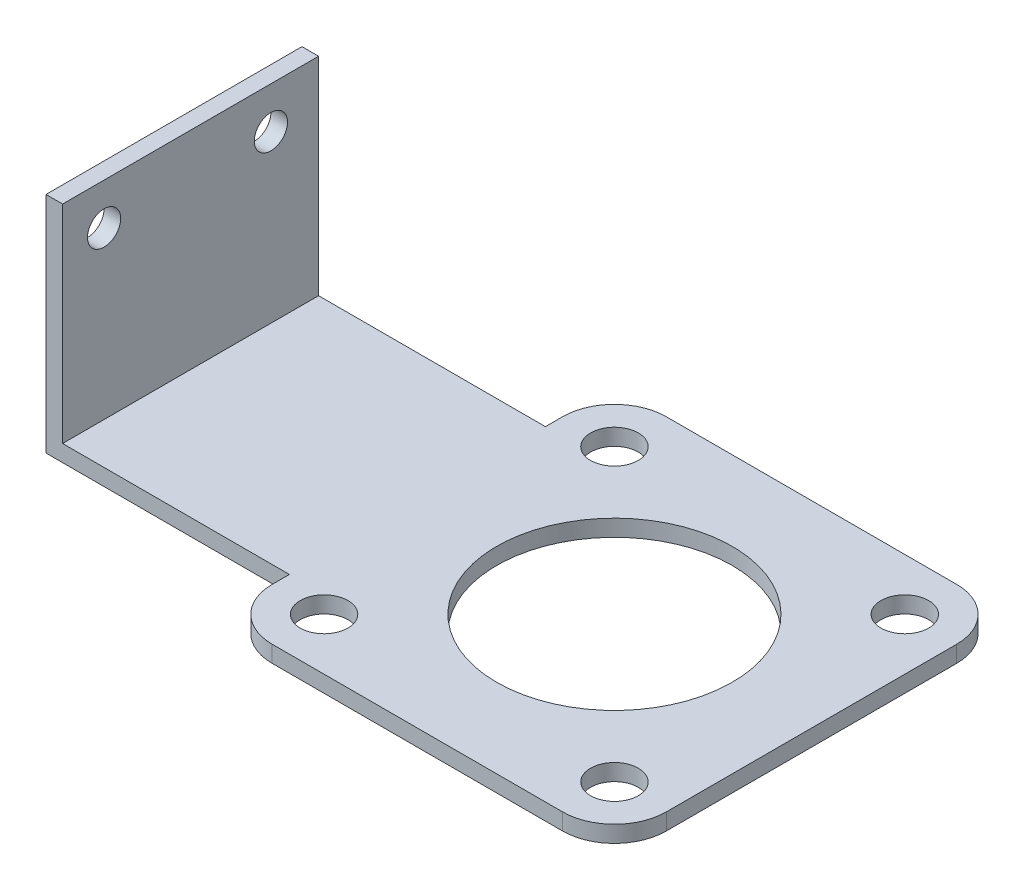
from build123d import *

# Parameters (mm, degrees)
BOSS_EXTRUDE1_DEPTH     = 4
CUT_EXTRUDE1_DEPTH      = 10
CUT_EXTRUDE1_DEPTH_BACK = 10
SKETCH2_R               = 5.75
BOSS_EXTRUDE5_DEPTH     = 58.68
SKETCH12_W              = 4
SKETCH12_H              = 61.717483032
BOSS_EXTRUDE8_DEPTH     = 50
SKETCH13_R              = 4
CUT_EXTRUDE5_DEPTH      = 20
SKETCH14_R              = 28.395
CUT_EXTRUDE6_DEPTH      = 10


with BuildPart() as part:
    # Sketch1 → Boss-Extrude1 (new body)
    with BuildSketch(Plane(origin=(0, 0, 0), x_dir=(1, 0, 0), z_dir=(0, 1, 0))):
        with BuildLine():
            Line((12.5, 0), (82.5, 0))
            ThreePointArc((82.5, 0), (91.338834765, 3.661165235), (95, 12.5))
            Line((95, 12.5), (95, 82.5))
            ThreePointArc((95, 82.5), (91.338834765, 91.338834765), (82.5, 95))
            Line((82.5, 95), (12.5, 95))
            ThreePointArc((12.5, 95), (3.661165235, 91.338834765), (0, 82.5))
            Line((0, 82.5), (0, 12.5))
            ThreePointArc((0, 12.5), (3.661165235, 3.661165235), (12.5, 0))
        make_face()
    extrude(amount=BOSS_EXTRUDE1_DEPTH)

    # Sketch2 → Cut-Extrude1 (cut, two sides: drawn at the far end of the back side and taken through both)
    with BuildSketch(Plane(origin=(0, 4, 0), x_dir=(1, 0, 0), z_dir=(0, 1, 0)).offset(-CUT_EXTRUDE1_DEPTH_BACK)):
        with Locations(Location((12.5, 82.5, 0), (0, 0, 90))):
            Circle(SKETCH2_R)
        with Locations(Location((82.5, 82.5, 0), (0, 0, 90))):
            Circle(SKETCH2_R)
        with Locations(Location((12.5, 12.5, 0), (0, 0, 90))):
            Circle(SKETCH2_R)
        with Locations(Location((82.5, 12.5, 0), (0, 0, 90))):
            Circle(SKETCH2_R)
    extrude(amount=CUT_EXTRUDE1_DEPTH + CUT_EXTRUDE1_DEPTH_BACK, mode=Mode.SUBTRACT)

    # Sketch8 → Boss-Extrude5 (add)
    with BuildSketch(Plane.ZY):
        Polygon((-17.641258484, 4), (-16.641258484, 4), (-16.641258484, 0), (-78.358741516, 0), (-78.358741516, 4), (-77.358741516, 4), align=None)
    extrude(amount=BOSS_EXTRUDE5_DEPTH)

    # Sketch12 → Boss-Extrude8 (add)
    with BuildSketch(Plane(origin=(0, 4, 0), x_dir=(1, 0, 0), z_dir=(0, 1, 0))):
        with Locations((-56.68, 47.5)):
            Rectangle(SKETCH12_W, SKETCH12_H)
    extrude(amount=BOSS_EXTRUDE8_DEPTH)

    # Sketch13 → Cut-Extrude5 (cut)
    with BuildSketch(Plane.ZY.offset(58.68)):
        with Locations((-66.858741516, 44)):
            Circle(SKETCH13_R)
        with Locations((-26.641258484, 44)):
            Circle(SKETCH13_R)
    extrude(amount=-CUT_EXTRUDE5_DEPTH, mode=Mode.SUBTRACT)

    # Sketch14 → Cut-Extrude6 (cut)
    with BuildSketch(Plane(origin=(0, 4, 0), x_dir=(1, 0, 0), z_dir=(0, 1, 0))):
        with Locations(Location((47.5, 47.5, 0), (0, 0, 270))):
            Circle(SKETCH14_R)
    extrude(amount=-CUT_EXTRUDE6_DEPTH, mode=Mode.SUBTRACT)


solid = part.part
